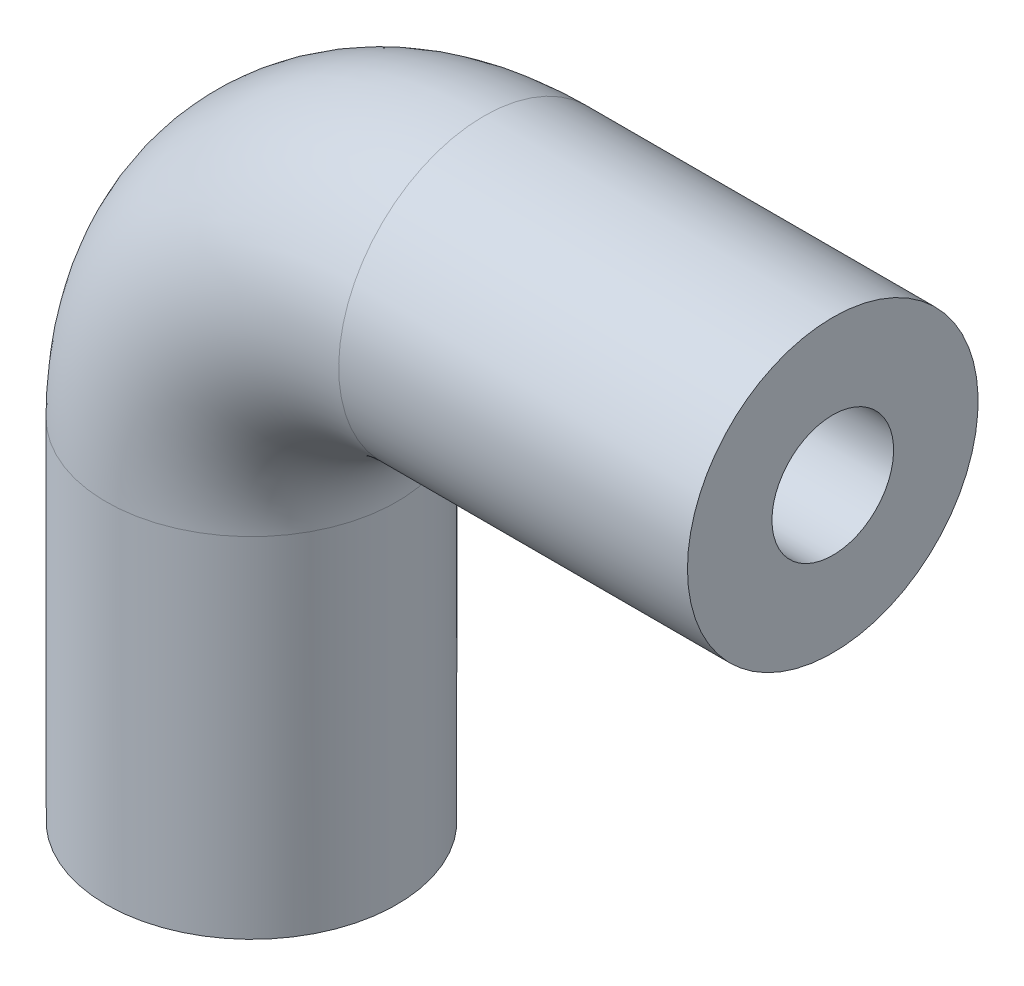
from build123d import *

# Parameters (mm, degrees)
SKETCH_2_R   = 5
SKETCH_2_R_2 = 2.092708753


with BuildPart() as part:
    # 扫描1: sweep along a path in 草图1
    with BuildLine(Plane.XY) as sweep_1_path:
        Line((0, 0), (0, 12))
        ThreePointArc((0, 12), (2.343145751, 17.656854249), (8, 20))
        Line((8, 20), (20, 20))
    # 草图2 → 扫描1 (sweep)
    with BuildSketch(Plane(origin=(0, 0, 0), x_dir=(1, 0, 0), z_dir=(0, 1, 0))):
        Circle(SKETCH_2_R)
        Circle(SKETCH_2_R_2, mode=Mode.SUBTRACT)
    sweep(path=sweep_1_path.line)


solid = part.part
